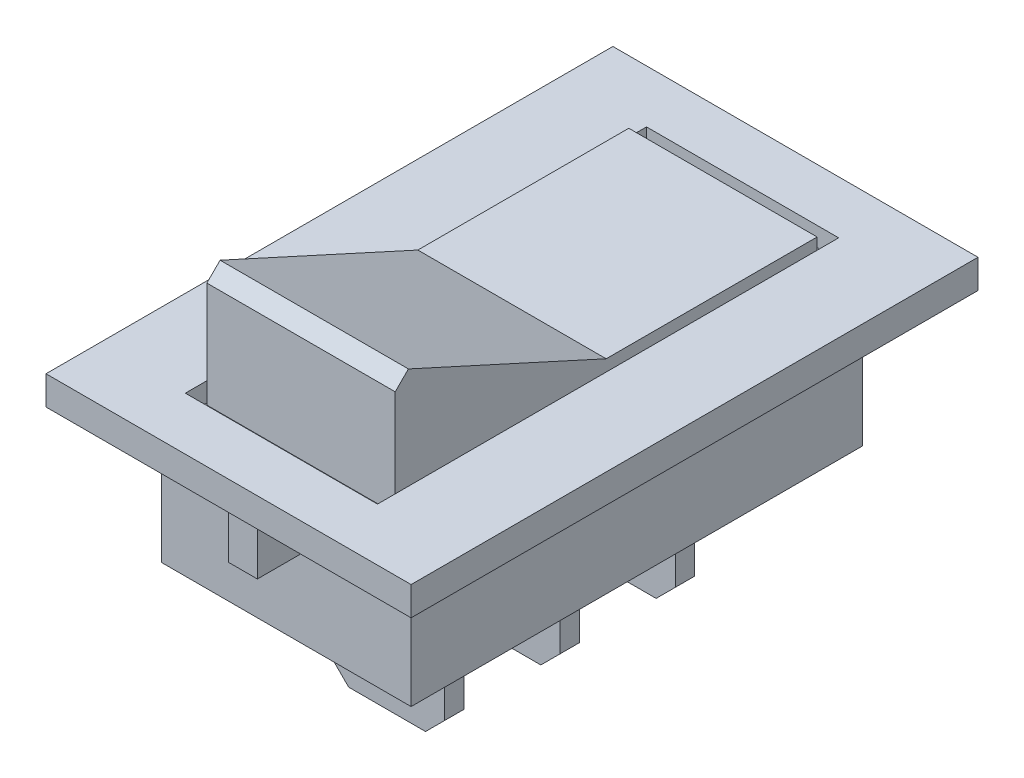
from build123d import *

# Parameters (mm, degrees)
BOSS_EXTRUDE1_DEPTH      = 3
SKETCH2_W                = 13
SKETCH2_H                = 23.5
BOSS_EXTRUDE2_DEPTH      = 4
SKETCH3_W                = 6
SKETCH3_H                = 1
BOSS_EXTRUDE3_DEPTH      = 6
CHAMFER1_SIZE            = 1
SKETCH4_W                = 19
SKETCH4_H                = 29.5
BOSS_EXTRUDE4_DEPTH      = 1.5
SKETCH5_W                = 10
SKETCH5_H                = 24
CUT_EXTRUDE1_DEPTH       = 1
BOSS_EXTRUDE5_DEPTH      = 4.9
BOSS_EXTRUDE5_DEPTH_BACK = 4.9
CHAMFER2_SIZE            = 1
CHAMFER2_SIZE2           = 0.754975442


with BuildPart() as part:
    # Sketch1 → Boss-Extrude1 (new body)
    with BuildSketch(Plane(origin=(0, 0, 0), x_dir=(1, 0, 0), z_dir=(0, 1, 0))):
        Polygon((0.75, -11.75), (6.5, -11.75), (6.5, 11.75), (0.75, 11.75), (0.75, 14), (-0.75, 14), (-0.75, 11.75), (-6.5, 11.75), (-6.5, -11.75), (-0.75, -11.75), (-0.75, -14), (0.75, -14), align=None)
    extrude(amount=-BOSS_EXTRUDE1_DEPTH)

    # Sketch2 → Boss-Extrude2 (add)
    with BuildSketch(Plane.XZ.offset(3)):
        Rectangle(SKETCH2_W, SKETCH2_H)
    extrude(amount=BOSS_EXTRUDE2_DEPTH)

    # Sketch3 → Boss-Extrude3 (add)
    with BuildSketch(Plane.XZ.offset(7)):
        Rectangle(SKETCH3_W, SKETCH3_H)
        with Locations((0, 6)):
            Rectangle(SKETCH3_W, SKETCH3_H)
        with Locations((0, -6)):
            Rectangle(SKETCH3_W, SKETCH3_H)
    extrude(amount=BOSS_EXTRUDE3_DEPTH)

    # Chamfer1
    chamfer1_edges = [part.edges().sort_by_distance(p)[0] for p in [
        (-3, -13, 0),
        (3, -13, 0),
        (-3, -13, 6),
        (3, -13, 6),
        (3, -13, -6),
        (-3, -13, -6),
    ]]
    chamfer(chamfer1_edges, length=CHAMFER1_SIZE)

    # Sketch4 → Boss-Extrude4 (add)
    with BuildSketch(Plane(origin=(0, 0, 0), x_dir=(1, 0, 0), z_dir=(0, 1, 0))):
        Rectangle(SKETCH4_W, SKETCH4_H)
    extrude(amount=BOSS_EXTRUDE4_DEPTH)

    # Sketch5 → Cut-Extrude1 (cut)
    with BuildSketch(Plane(origin=(0, 1.5, 0), x_dir=(1, 0, 0), z_dir=(0, 1, 0))):
        Rectangle(SKETCH5_W, SKETCH5_H)
    extrude(amount=-CUT_EXTRUDE1_DEPTH, mode=Mode.SUBTRACT)

    # Sketch6 → Boss-Extrude5 (add, two sides: drawn at the far end of the back side and taken through both)
    with BuildSketch(Plane(origin=(0, 0, 0), x_dir=(0, 0, -1), z_dir=(1, 0, 0)).offset(-BOSS_EXTRUDE5_DEPTH_BACK)):
        Polygon((-10.977846987, 0), (10.977846987, 0), (10.977846987, 2), (0, 2), (-10.977846987, 7), align=None)
    extrude(amount=BOSS_EXTRUDE5_DEPTH + BOSS_EXTRUDE5_DEPTH_BACK)

    # Chamfer2
    chamfer2_edges = [part.edges().sort_by_distance(p)[0] for p in [
        (0, 7, 10.977846987),
    ]]
    chamfer2_side = [part.faces().sort_by_distance(p)[0] for p in [
        (0, 3.75, 10.977846987),
    ]]
    chamfer(chamfer2_edges, length=CHAMFER2_SIZE, length2=CHAMFER2_SIZE2, reference=chamfer2_side[0])


solid = part.part
